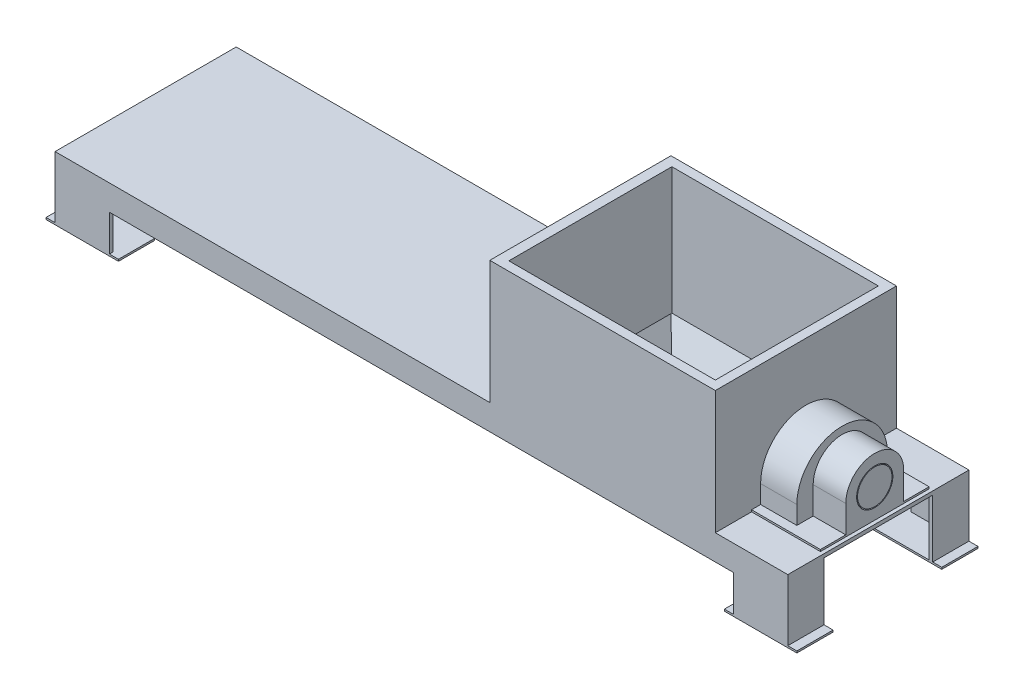
from build123d import *

# Parameters (mm, degrees)
SKETCH1_W           = 4045
SKETCH1_H           = 1000
BOSS_EXTRUDE1_DEPTH = 340
SKETCH2_W           = 4045
SKETCH2_H           = 600
CUT_EXTRUDE1_DEPTH  = 320
SKETCH3_W           = 3445
SKETCH3_H           = 200
CUT_EXTRUDE2_DEPTH  = 200
SKETCH4_W           = 400
SKETCH4_H           = 200
BOSS_EXTRUDE2_DEPTH = 10
SKETCH5_W           = 1245
SKETCH5_H           = 1000
BOSS_EXTRUDE3_DEPTH = 680
CUT_EXTRUDE3_START  = -10
SKETCH6_W           = 4005
SKETCH6_H           = 960
CUT_EXTRUDE3_DEPTH  = 320
SKETCH7_W           = 1140
SKETCH7_H           = 900
CUT_EXTRUDE5_DEPTH  = 4274.058038454
SKETCH7_3_W         = 1180
SKETCH7_3_H         = 940
BOSS_EXTRUDE4_DEPTH = 180
DRAFT3_ANGLE        = -30
BOSS_EXTRUDE5_REACH = 4150.665
SKETCH13_R          = 100
BOSS_EXTRUDE6_DEPTH = 180
SKETCH14_W          = 380
SKETCH14_H          = 600
BOSS_EXTRUDE7_DEPTH = 10
SKETCH15_R          = 95
BOSS_EXTRUDE8_DEPTH = 180


with BuildPart() as part:
    # Sketch1 → Boss-Extrude1 (new body)
    with BuildSketch(Plane(origin=(0, 0, 0), x_dir=(1, 0, 0), z_dir=(0, 1, 0))):
        with Locations((2022.5, 500)):
            Rectangle(SKETCH1_W, SKETCH1_H)
    extrude(amount=BOSS_EXTRUDE1_DEPTH)

    # Sketch2 → Cut-Extrude1 (cut)
    with BuildSketch(Plane.XZ):
        with Locations((2022.5, -500)):
            Rectangle(SKETCH2_W, SKETCH2_H)
    extrude(amount=-CUT_EXTRUDE1_DEPTH, mode=Mode.SUBTRACT)

    # Sketch3 → Cut-Extrude2 (cut)
    with BuildSketch(Plane.XZ):
        with Locations((2022.5, -100)):
            Rectangle(SKETCH3_W, SKETCH3_H)
        with Locations((2022.5, -900)):
            Rectangle(SKETCH3_W, SKETCH3_H)
    extrude(amount=-CUT_EXTRUDE2_DEPTH, mode=Mode.SUBTRACT)

    # Sketch4 → Boss-Extrude2 (add)
    with BuildSketch(Plane.XZ):
        with Locations((150, -100)):
            Rectangle(SKETCH4_W, SKETCH4_H)
        with Locations((3895, -100)):
            Rectangle(SKETCH4_W, SKETCH4_H)
        with Locations((3895, -900)):
            Rectangle(SKETCH4_W, SKETCH4_H)
        with Locations((150, -900)):
            Rectangle(SKETCH4_W, SKETCH4_H)
    extrude(amount=BOSS_EXTRUDE2_DEPTH)

    # Sketch5 → Boss-Extrude3 (add)
    with BuildSketch(Plane(origin=(0, 340, 0), x_dir=(1, 0, 0), z_dir=(0, 1, 0))):
        with Locations((3022.5, 500)):
            Rectangle(SKETCH5_W, SKETCH5_H)
    extrude(amount=BOSS_EXTRUDE3_DEPTH)

    # Sketch6 → Cut-Extrude3 (cut)
    with BuildSketch(Plane.XZ.offset(10).offset(CUT_EXTRUDE3_START)):
        with Locations((2022.5, -500)):
            Rectangle(SKETCH6_W, SKETCH6_H)
    extrude(amount=-CUT_EXTRUDE3_DEPTH, mode=Mode.SUBTRACT)

    # Sketch7 → Cut-Extrude5 (cut, through all)
    with BuildSketch(Plane.XZ.offset(-320)):
        with Locations((3025, -500)):
            Rectangle(SKETCH7_W, SKETCH7_H)
    extrude(amount=-CUT_EXTRUDE5_DEPTH, mode=Mode.SUBTRACT)

    # Sketch7<3> → Boss-Extrude4 (add)
    with BuildSketch(Plane.XZ.offset(-320)):
        with Locations((3025, -500)):
            Rectangle(SKETCH7_3_W, SKETCH7_3_H)
    extrude(amount=BOSS_EXTRUDE4_DEPTH)

    # Draft3
    draft3_faces = [part.faces().sort_by_distance(p)[0] for p in [
        (3025, 230, -30),
        (3615, 230, -500),
        (3025, 230, -970),
        (2435, 230, -500),
    ]]
    draft(draft3_faces, Plane.ZX.offset(320), DRAFT3_ANGLE)

    # Sketch8 → Cut-Loft2 section 0
    with BuildSketch(Plane(origin=(0, 320, 0), x_dir=(1, 0, 0), z_dir=(0, 1, 0))):
        with BuildLine():
            Line((3595, 50), (2450, 50))
            Line((2450, 50), (2450, 950))
            Line((2450, 950), (3595, 950))
            Line((3595, 950), (3595, 50))
        make_face()
    # Sketch10 → Cut-Loft2 section 1
    with BuildSketch(Plane.XZ.offset(-140)):
        with BuildLine():
            Line((2558.923048454, -153.923048454), (3491.076951546, -153.923048454))
            Line((3491.076951546, -153.923048454), (3491.076951546, -846.076951546))
            Line((3491.076951546, -846.076951546), (2558.923048454, -846.076951546))
            Line((2558.923048454, -846.076951546), (2558.923048454, -153.923048454))
        make_face()
    loft(mode=Mode.SUBTRACT)

    # Sketch12 → Boss-Extrude5 (add, up to next)
    with BuildSketch(Plane(origin=(3845, 0, 0), x_dir=(0, 0, -1), z_dir=(1, 0, 0)), mode=Mode.PRIVATE) as boss_extrude5_sk1:
        with BuildLine():
            Line((250, 450), (250, 350))
            Line((250, 350), (750, 350))
            Line((750, 350), (750, 450))
            ThreePointArc((750, 450), (500, 700), (250, 450))
        make_face()
    boss_extrude5_tool1 = extrude(boss_extrude5_sk1.sketch, amount=-BOSS_EXTRUDE5_REACH, mode=Mode.PRIVATE) - part.part
    add(boss_extrude5_tool1.solids().sort_by_distance((3845, 503.427899, -500))[0])

    # Sketch13 → Boss-Extrude6 (add)
    with BuildSketch(Plane(origin=(3845, 0, 0), x_dir=(0, 0, -1), z_dir=(1, 0, 0))):
        with BuildLine():
            Line((340, 500), (340, 340))
            Line((340, 340), (660, 340))
            Line((660, 340), (660, 500))
            ThreePointArc((660, 500), (500, 660), (340, 500))
        make_face()
        with Locations(Location((500, 500, 0), (0, 0, 180))):
            Circle(SKETCH13_R, mode=Mode.SUBTRACT)
    extrude(amount=BOSS_EXTRUDE6_DEPTH)

    # Sketch14 → Boss-Extrude7 (add)
    with BuildSketch(Plane(origin=(0, 340, 0), x_dir=(1, 0, 0), z_dir=(0, 1, 0))):
        with Locations((3835, 500)):
            Rectangle(SKETCH14_W, SKETCH14_H)
    extrude(amount=BOSS_EXTRUDE7_DEPTH)

    # Sketch15 → Boss-Extrude8 (add)
    with BuildSketch(Plane(origin=(3845, 0, 0), x_dir=(0, 0, -1), z_dir=(1, 0, 0))):
        with Locations((500, 500)):
            Circle(SKETCH15_R)
    extrude(amount=BOSS_EXTRUDE8_DEPTH)


solid = part.part
